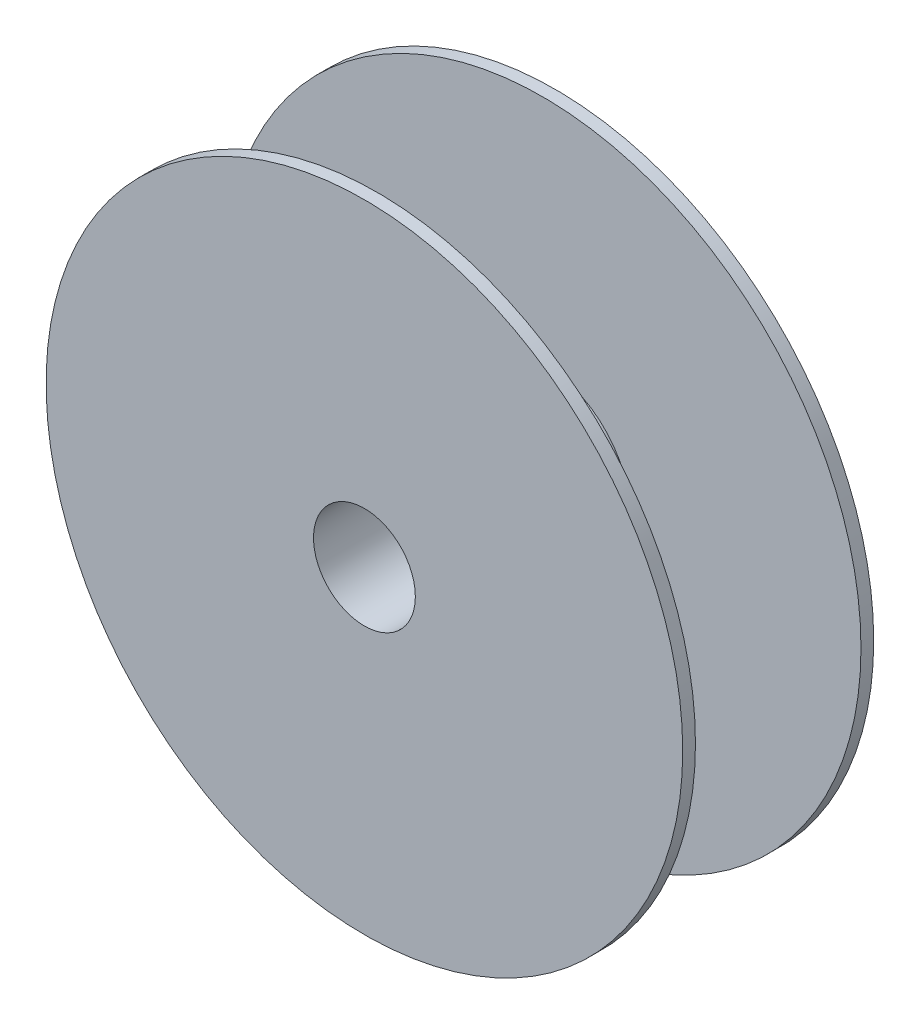
from build123d import *

# Parameters (mm, degrees)
SKETCH1_R           = 100
SKETCH1_R_2         = 26.25
SKETCH1_R_3         = 16.000000004
BOSS_EXTRUDE1_DEPTH = 30
SKETCH2_R           = 100
SKETCH2_R_2         = 27.5
CUT_EXTRUDE1_DEPTH  = 26


with BuildPart() as part:
    # Sketch1 → Boss-Extrude1 (new, symmetric)
    # profile 1 of 2: a face of its own
    with BuildSketch(Plane.XY):
        Circle(SKETCH1_R)
        Circle(SKETCH1_R_2, mode=Mode.SUBTRACT)
    # profile 2 of 2: a face of its own
    with BuildSketch(Plane.XY):
        Circle(SKETCH1_R_2)
        Circle(SKETCH1_R_3, mode=Mode.SUBTRACT)
    extrude(amount=BOSS_EXTRUDE1_DEPTH, both=True)

    # Sketch2 → Cut-Extrude1 (cut, symmetric)
    with BuildSketch(Plane.XY):
        Circle(SKETCH2_R)
        Circle(SKETCH2_R_2, mode=Mode.SUBTRACT)
    extrude(amount=CUT_EXTRUDE1_DEPTH, both=True, mode=Mode.SUBTRACT)


solid = part.part
